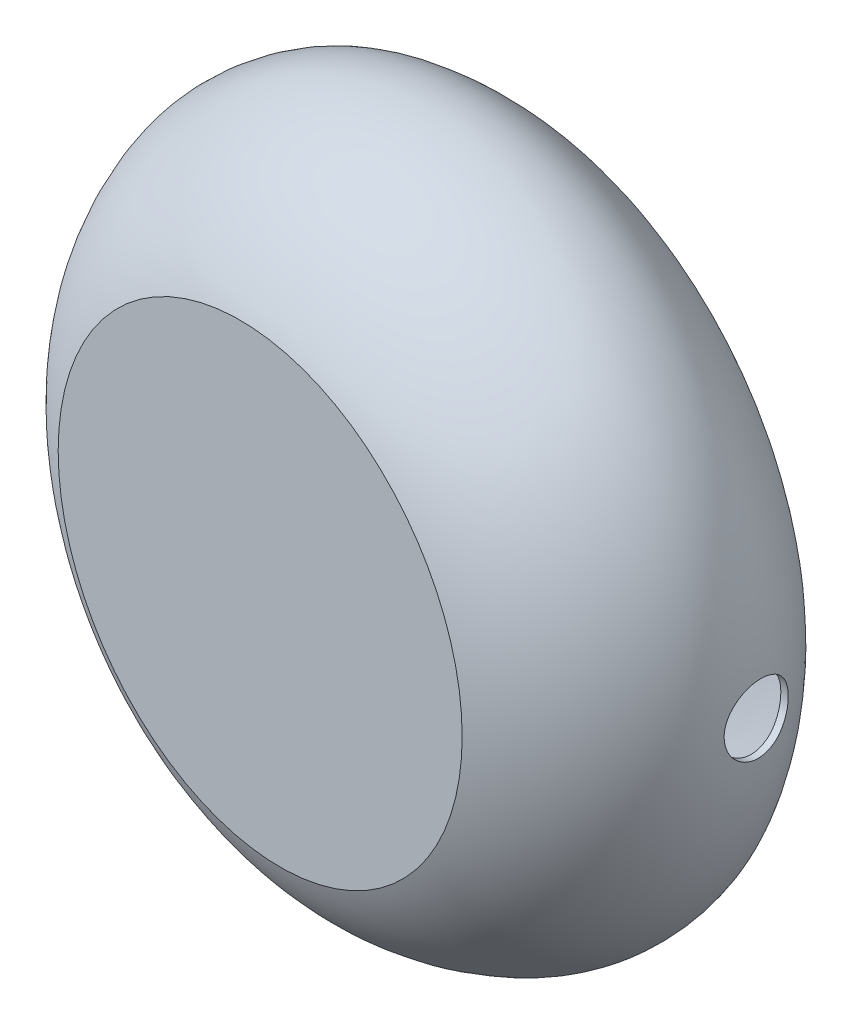
from build123d import *

# Parameters (mm, degrees)
CUT_EXTRUDE1_DEPTH      = 50
CUT_EXTRUDE1_DEPTH_BACK = 70


with BuildPart() as part:
    # Sketch1 → Revolve1 (revolve)
    with BuildSketch(Plane(origin=(0, 0, 0), x_dir=(1, 0, 0), z_dir=(0, 1, 0)), mode=Mode.PRIVATE) as revolve1_sk:
        with BuildLine():
            Line((-17.390305115, 2.124583061), (14.766271873, -1.111666818))
            add(Edge.make_bspline(
                [(10.956417288, 41.483920674), (16.74681705, 39.890941059), (24.485270687, 37.36465709), (29.410773727, 31.188778955), (30.237298128, 30.000217702), (31.400446331, 28.327583618), (33.40068732, 24.755576816), (33.4337047, 17.197544652), (31.79538449, 13.440122533), (30.78230115, 11.67255905), (27.218965589, 5.455477424), (21.618498961, 0.985104082), (14.766271873, -1.111666818)],
                knots=[0, 0, 0, 0, 0.295285165, 0.366179967, 0.366179967, 0.366179967, 0.465948541, 0.565717116, 0.66548569, 0.66548569, 0.66548569, 1, 1, 1, 1], degree=3, weights=[1, 1, 1, 1, 1, 1, 1, 1, 1, 1, 0.953255645, 0.953255645, 1]))
            Line((10.956417288, 41.483920674), (11.2216697, 42.448099681))
            add(Edge.make_bspline(
                [(14.866406417, -2.126795879), (15.501349931, -1.932504145), (16.755695967, -1.517109621), (19.252697037, -0.477498508), (22.256139934, 1.1585776), (25.570858626, 3.63867721), (28.490346219, 6.554372412), (30.926075083, 9.822831749), (32.872612496, 13.276091399), (34.19797199, 17.311946034), (34.410418717, 21.282646362), (34.00188151, 24.344230747), (33.159118171, 27.157244874), (31.817130359, 29.522907472), (30.280569656, 31.67728545), (28.964265299, 33.288113896), (27.49671755, 34.781872637), (24.324763994, 37.421830742), (20.062713709, 39.611761078), (15.620282137, 41.162141244), (13.086533798, 41.927806312), (11.846759595, 42.276133064), (11.2216697, 42.448099681)],
                knots=[0, 0, 0, 0, 0.031352676, 0.062705352, 0.125410703, 0.188116055, 0.250821407, 0.313526759, 0.37623211, 0.438937462, 0.501642814, 0.53299549, 0.564348166, 0.627053517, 0.658406193, 0.689758869, 0.721111545, 0.752464221, 0.877874924, 0.940580276, 0.971932952, 1.003285628, 1.003285628, 1.003285628, 1.003285628], degree=3))
            Line((14.866406417, -2.126795879), (-17.490439659, 1.129609155))
            Line((-17.490439659, 1.129609155), (-17.390305115, 2.124583061))
        make_face()
    revolve(revolve1_sk.sketch.rotate(Axis((-13.085932221, 0, -44.894425787), (0.10013454426923565, 0, -0.9949739057100907)), 180), axis=Axis((-13.085932221, 0, -44.894425787), (0.10013454426923565, 0, -0.9949739057100907)))

    # Sketch2 → Cut-Extrude1 (cut, two sides: drawn at the far end of the back side and taken through both)
    with BuildSketch(Plane(origin=(0, 0, 0), x_dir=(0, 0, -1), z_dir=(1, 0, 0)).offset(-CUT_EXTRUDE1_DEPTH_BACK)):
        with BuildLine():
            Line((16.62729586, 0), (21.5, 0))
            Line((21.5, 0), (26.37270414, 0))
            ThreePointArc((26.37270414, 0), (21.5, 4.87270414), (16.62729586, 0))
        make_face()
        with BuildLine():
            Line((26.37270414, 0), (21.5, 0))
            Line((21.5, 0), (16.62729586, 0))
            ThreePointArc((16.62729586, 0), (21.5, -4.87270414), (26.37270414, 0))
        make_face()
    extrude(amount=CUT_EXTRUDE1_DEPTH + CUT_EXTRUDE1_DEPTH_BACK, mode=Mode.SUBTRACT)


solid = part.part
